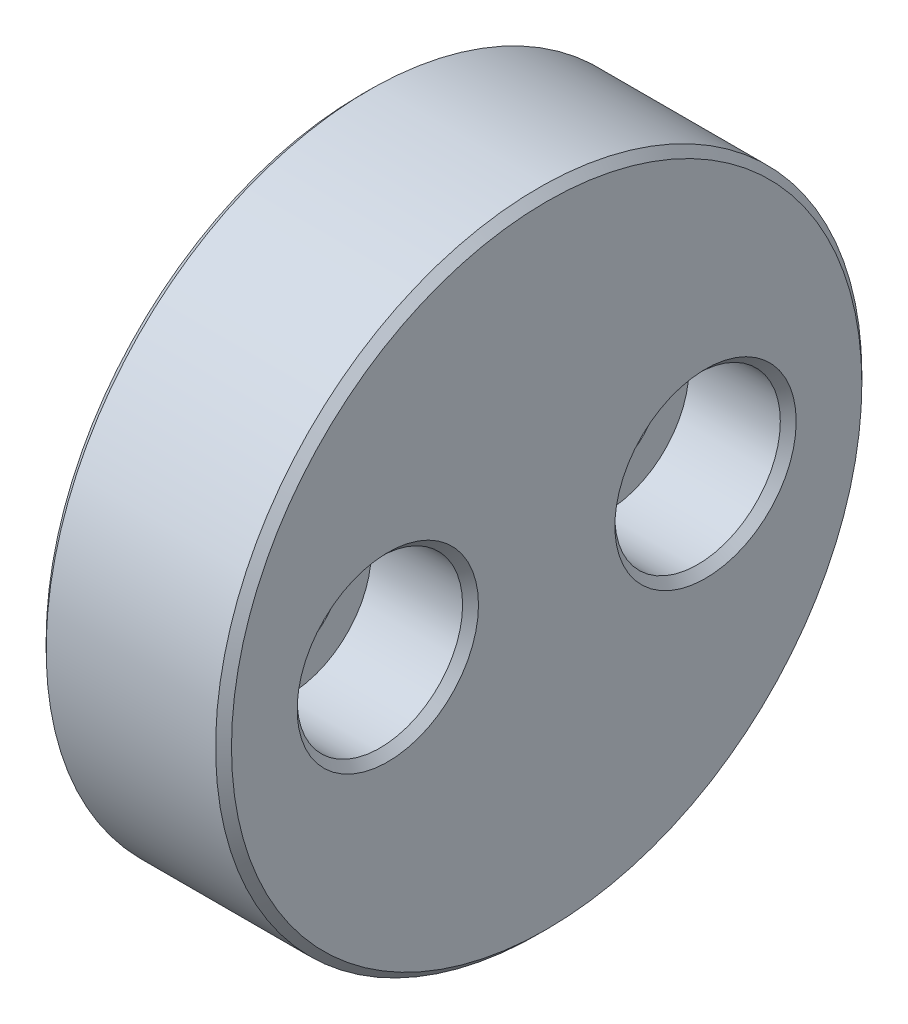
from build123d import *

# Parameters (mm, degrees)
SKETCH1_R                                        = 31
BOSS_EXTRUDE1_DEPTH                              = 17.78
CBORE_FOR_3_8_SOCKET_HEAD_CAP_SCREW1_D           = 9.8044
CBORE_FOR_3_8_SOCKET_HEAD_CAP_SCREW1_DEPTH       = 23.8252
CBORE_FOR_3_8_SOCKET_HEAD_CAP_SCREW1_CBORE_D     = 15.875
CBORE_FOR_3_8_SOCKET_HEAD_CAP_SCREW1_CBORE_DEPTH = 9.525
CBORE_FOR_3_8_SOCKET_HEAD_CAP_SCREW1_TIP         = 2.945538927
CHAMFER1_SIZE                                    = 0.762


with BuildPart() as part:
    # Sketch1 → Boss-Extrude1 (new body)
    with BuildSketch(Plane(origin=(0, 0, 0), x_dir=(0, 0, -1), z_dir=(1, 0, 0))):
        Circle(SKETCH1_R)
    extrude(amount=BOSS_EXTRUDE1_DEPTH)

    # CBORE for 3/8 Socket Head Cap Screw1
    with Locations(Plane(origin=(17.78, 0, 0), x_dir=(0, 0, -1), z_dir=(1, 0, 0))):
        with Locations((-15.24, 0), (15.24, 0)):
            CounterBoreHole(CBORE_FOR_3_8_SOCKET_HEAD_CAP_SCREW1_D / 2, CBORE_FOR_3_8_SOCKET_HEAD_CAP_SCREW1_CBORE_D / 2, CBORE_FOR_3_8_SOCKET_HEAD_CAP_SCREW1_CBORE_DEPTH, depth=CBORE_FOR_3_8_SOCKET_HEAD_CAP_SCREW1_DEPTH)
            with Locations((0, 0, -(CBORE_FOR_3_8_SOCKET_HEAD_CAP_SCREW1_DEPTH + CBORE_FOR_3_8_SOCKET_HEAD_CAP_SCREW1_TIP / 2))):  # 118° drill point
                Cone(0, CBORE_FOR_3_8_SOCKET_HEAD_CAP_SCREW1_D / 2, CBORE_FOR_3_8_SOCKET_HEAD_CAP_SCREW1_TIP, mode=Mode.SUBTRACT)

    # Chamfer1
    chamfer1_edges = [part.edges().sort_by_distance(p)[0] for p in [
        (17.78, 0, 23.1775),
        (0, 0, 31),
        (17.78, 0, 31),
        (17.78, 0, -7.3025),
    ]]
    chamfer(chamfer1_edges, length=CHAMFER1_SIZE)


solid = part.part
